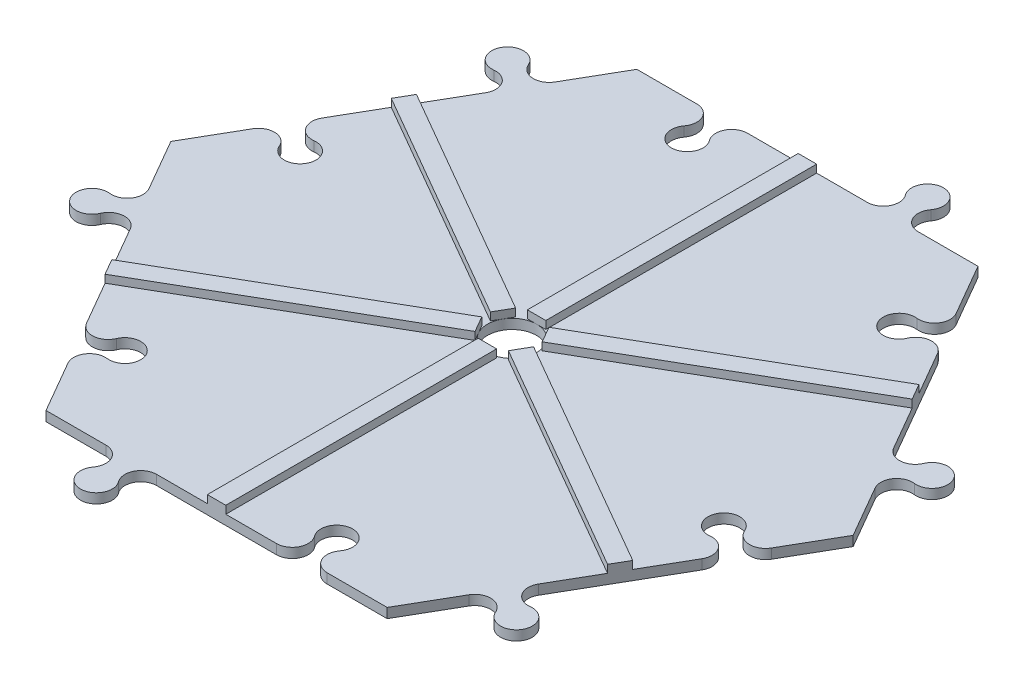
from build123d import *

# Parameters (mm, degrees)
BOSS_EXTRUDE1_DEPTH = 3.175
BOSS_EXTRUDE2_DEPTH = 3.175
CUT_EXTRUDE2_DEPTH  = 159.172640977
CIRPATTERN1_COUNT   = 6
SKETCH4_R           = 8.001
CUT_EXTRUDE3_DEPTH  = 3.175
BOSS_EXTRUDE3_DEPTH = 2.54
CIRPATTERN2_COUNT   = 6


with BuildPart() as part:
    # Sketch1 → Boss-Extrude1 (new body)
    with BuildSketch(Plane(origin=(0, 0, 0), x_dir=(1, 0, 0), z_dir=(0, 1, 0))):
        Polygon((55.499999998, -96.128819817), (110.999999996, 0), (55.499999998, 96.128819817), (-55.499999998, 96.128819817), (-110.999999996, 0), (-55.499999998, -96.128819817), align=None)
    extrude(amount=BOSS_EXTRUDE1_DEPTH)

    # Sketch2 → Boss-Extrude2 (add)
    with BuildSketch(Plane(origin=(0, 0, 0), x_dir=(1, 0, 0), z_dir=(0, 1, 0))):
        with BuildLine():
            ThreePointArc((23.622499999, 104.383819817), (24.109685288, 98.980852172), (19.494999999, 96.128819817))
            Line((19.494999999, 96.128819817), (36.004999999, 96.128819817))
            ThreePointArc((36.004999999, 96.128819817), (31.39031471, 98.980852172), (31.877499999, 104.383819817))
            ThreePointArc((31.877499999, 104.383819817), (32.364685288, 109.786787461), (27.749999999, 112.638819817))
            ThreePointArc((27.749999999, 112.638819817), (23.13531471, 109.786787461), (23.622499999, 104.383819817))
        make_face()
    boss_extrude2 = extrude(amount=BOSS_EXTRUDE2_DEPTH)

    # Sketch2<3> → Cut-Extrude2 (cut, through all)
    with BuildSketch(Plane(origin=(0, 0, 0), x_dir=(1, 0, 0), z_dir=(0, 1, 0))):
        with BuildLine():
            Line((-19.494999999, 96.128819817), (-36.004999999, 96.128819817))
            ThreePointArc((-36.004999999, 96.128819817), (-31.39031471, 93.276787461), (-31.877499999, 87.873819817))
            ThreePointArc((-31.877499999, 87.873819817), (-32.364685288, 82.470852172), (-27.749999999, 79.618819817))
            ThreePointArc((-27.749999999, 79.618819817), (-23.13531471, 82.470852172), (-23.622499999, 87.873819817))
            ThreePointArc((-23.622499999, 87.873819817), (-24.109685288, 93.276787461), (-19.494999999, 96.128819817))
        make_face()
    cut_extrude2 = extrude(amount=CUT_EXTRUDE2_DEPTH, mode=Mode.SUBTRACT)

    # CirPattern1: Boss-Extrude2, Cut-Extrude2 ×6 about axis
    cirpattern1_axis = Axis((0, 0, 0), (0, 1, 0))
    add([boss_extrude2.rotate(cirpattern1_axis, i * 360 / CIRPATTERN1_COUNT) for i in range(1, CIRPATTERN1_COUNT)])
    add([cut_extrude2.rotate(cirpattern1_axis, i * 360 / CIRPATTERN1_COUNT) for i in range(1, CIRPATTERN1_COUNT)], mode=Mode.SUBTRACT)

    # Sketch4 → Cut-Extrude3 (cut)
    with BuildSketch(Plane(origin=(0, 3.175, 0), x_dir=(1, 0, 0), z_dir=(0, 1, 0))):
        with Locations(Location((0, 0, 0), (0, 0, 270))):
            Circle(SKETCH4_R)
    extrude(amount=-CUT_EXTRUDE3_DEPTH, mode=Mode.SUBTRACT)

    # Sketch5 → Boss-Extrude3 (add)
    with BuildSketch(Plane(origin=(0, 3.175, 0), x_dir=(1, 0, 0), z_dir=(0, 1, 0))):
        Polygon((-8.429069256, -1.402423789), (-84.749999997, -45.466333697), (-83.249999997, -48.064409908), (-6.929069256, -4.0005), align=None)
        Polygon((-6.929069256, -4.0005), (-83.249999997, -48.064409908), (-81.749999997, -50.66248612), (-5.429069256, -6.598576211), align=None)
    boss_extrude3 = extrude(amount=BOSS_EXTRUDE3_DEPTH)

    # CirPattern2: Boss-Extrude3 ×6 about axis
    cirpattern2_axis = Axis((0, 0, 0), (0, 1, 0))
    for i in range(1, CIRPATTERN2_COUNT):
        add(boss_extrude3.rotate(cirpattern2_axis, i * 360 / CIRPATTERN2_COUNT))


solid = part.part
